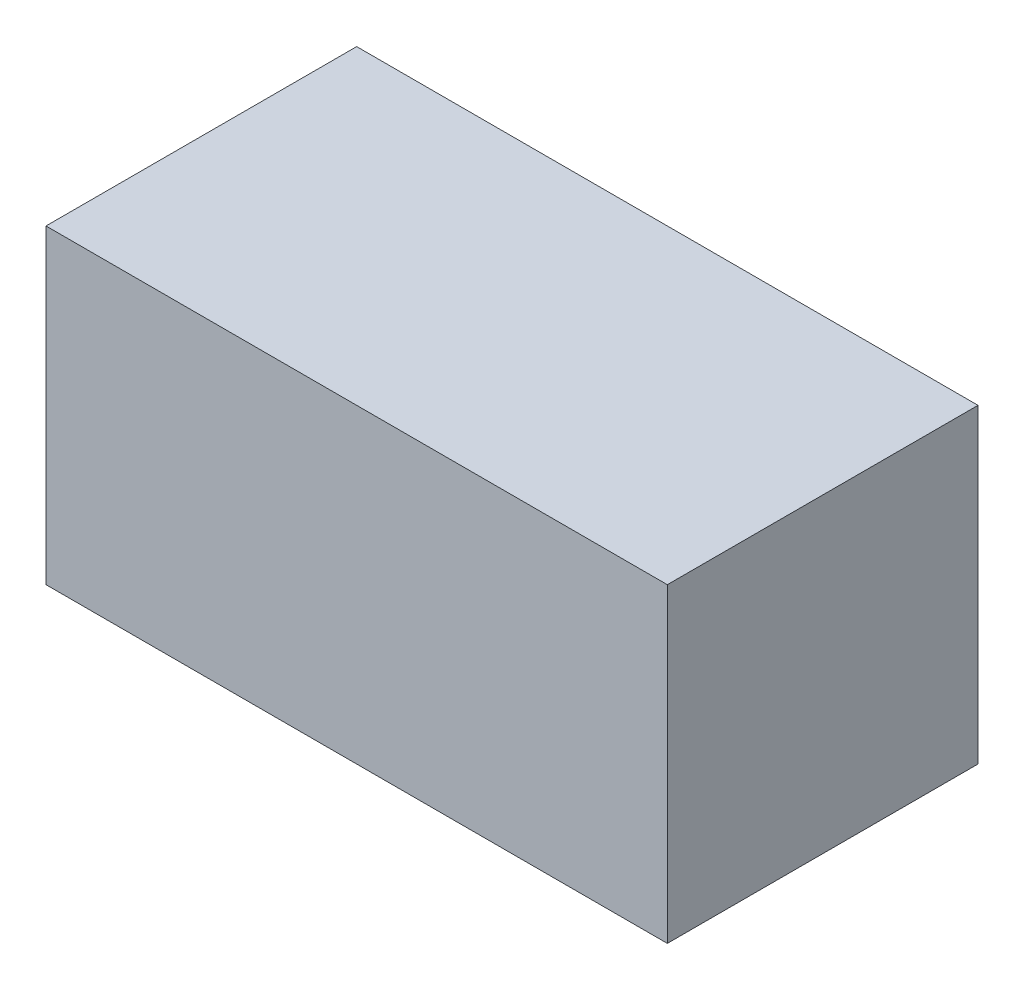
from build123d import *

# Parameters (mm, degrees)
SKETCH1_W           = 40
SKETCH1_H           = 20
BOSS_EXTRUDE1_DEPTH = 10
SKETCH2_R           = 4
CUT_EXTRUDE1_DEPTH  = 2.5


with BuildPart() as part:
    # Sketch1 → Boss-Extrude1 (new, symmetric)
    with BuildSketch(Plane.XY):
        with Locations((20, 10)):
            Rectangle(SKETCH1_W, SKETCH1_H)
    extrude(amount=BOSS_EXTRUDE1_DEPTH, both=True)

    # Sketch2 → Cut-Extrude1 (cut, symmetric)
    with BuildSketch(Plane.XY):
        with Locations((20, 10)):
            Circle(SKETCH2_R)
    extrude(amount=CUT_EXTRUDE1_DEPTH, both=True, mode=Mode.SUBTRACT)


solid = part.part
